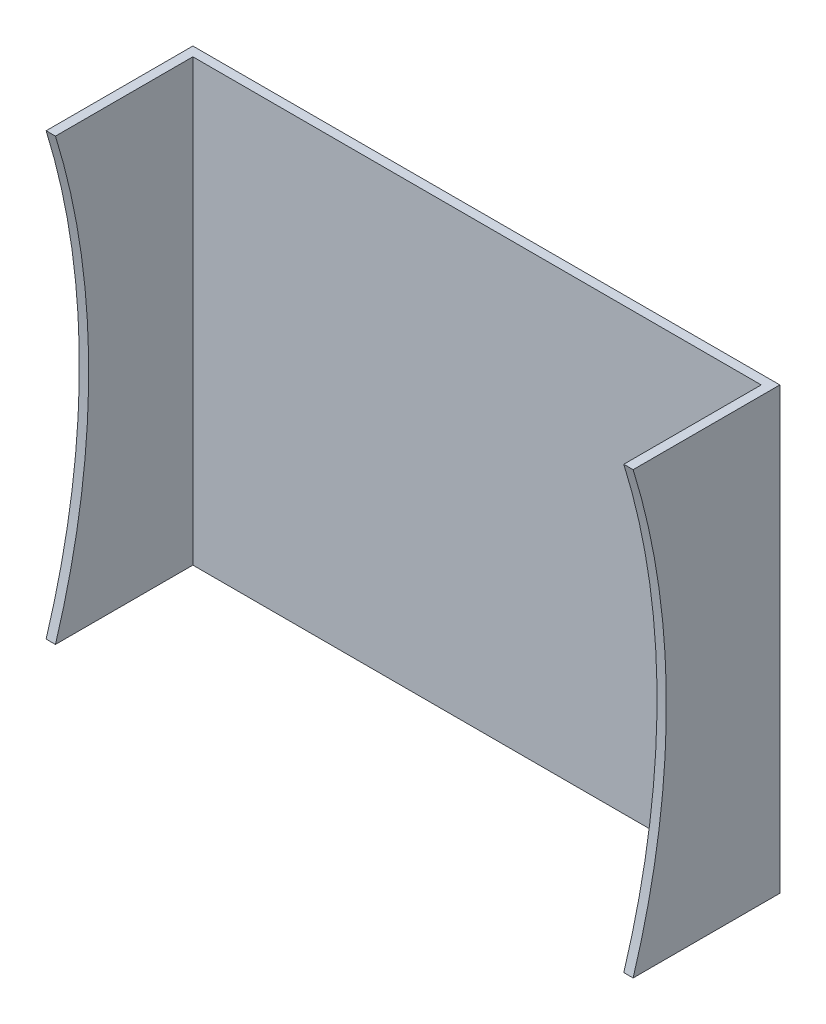
from build123d import *

# Parameters (mm, degrees)
BOSS_EXTRUDE3_DEPTH = 3.18
SKETCH1_5_W         = 3.18
SKETCH1_5_H         = 150
BOSS_EXTRUDE4_DEPTH = 100


with BuildPart() as part:
    # Sketch1 → Boss-Extrude3 (new body)
    with BuildSketch(Plane(origin=(0, 0, 0), x_dir=(0, 0, -1), z_dir=(1, 0, 0))):
        with BuildLine():
            Line((289.494679355, 75), (242.674679355, 75))
            ThreePointArc((242.674679355, 75), (254, 0), (242.674679355, -75))
            Line((242.674679355, -75), (289.494679355, -75))
            Line((289.494679355, -75), (289.494679355, 75))
        make_face()
    extrude(amount=BOSS_EXTRUDE3_DEPTH)

    # Sketch1<5> → Boss-Extrude4 (add)
    with BuildSketch(Plane(origin=(0, 0, 0), x_dir=(0, 0, -1), z_dir=(1, 0, 0))):
        with Locations((291.084679355, 0)):
            Rectangle(SKETCH1_5_W, SKETCH1_5_H)
    extrude(amount=BOSS_EXTRUDE4_DEPTH)

    # Mirror2: part across plane


with BuildPart() as part_1:
    add(part.part)
    add(part.part.mirror(Plane(origin=(100, 0, 0), x_dir=(0, 0, 1), z_dir=(1, 0, 0))))


solid = part_1.part
